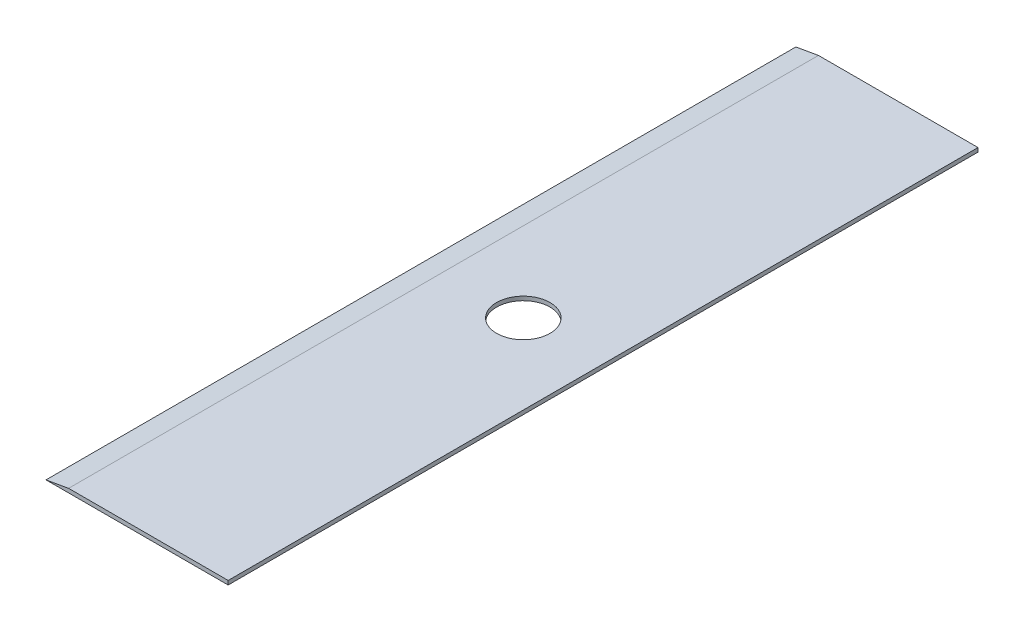
from build123d import *

# Parameters (mm, degrees)
BOSS_EXTRUDE1_DEPTH = 11.938
SKETCH3_R           = 0.8509
CUT_EXTRUDE1_DEPTH  = 0.127


with BuildPart() as part:
    # Sketch2 → Boss-Extrude1 (new, symmetric)
    with BuildSketch(Plane.XY):
        Polygon((0, 0), (5.08, 0), (5.08, 0.127), (0, 0.127), (-0.720252791, 0), align=None)
    extrude(amount=BOSS_EXTRUDE1_DEPTH, both=True)

    # Sketch3 → Cut-Extrude1 (cut)
    with BuildSketch(Plane(origin=(0, 0.127, 0), x_dir=(1, 0, 0), z_dir=(0, 1, 0))):
        with Locations(Location((2.54, 0, 0), (0, 0, 180))):
            Circle(SKETCH3_R)
    extrude(amount=-CUT_EXTRUDE1_DEPTH, mode=Mode.SUBTRACT)


solid = part.part
